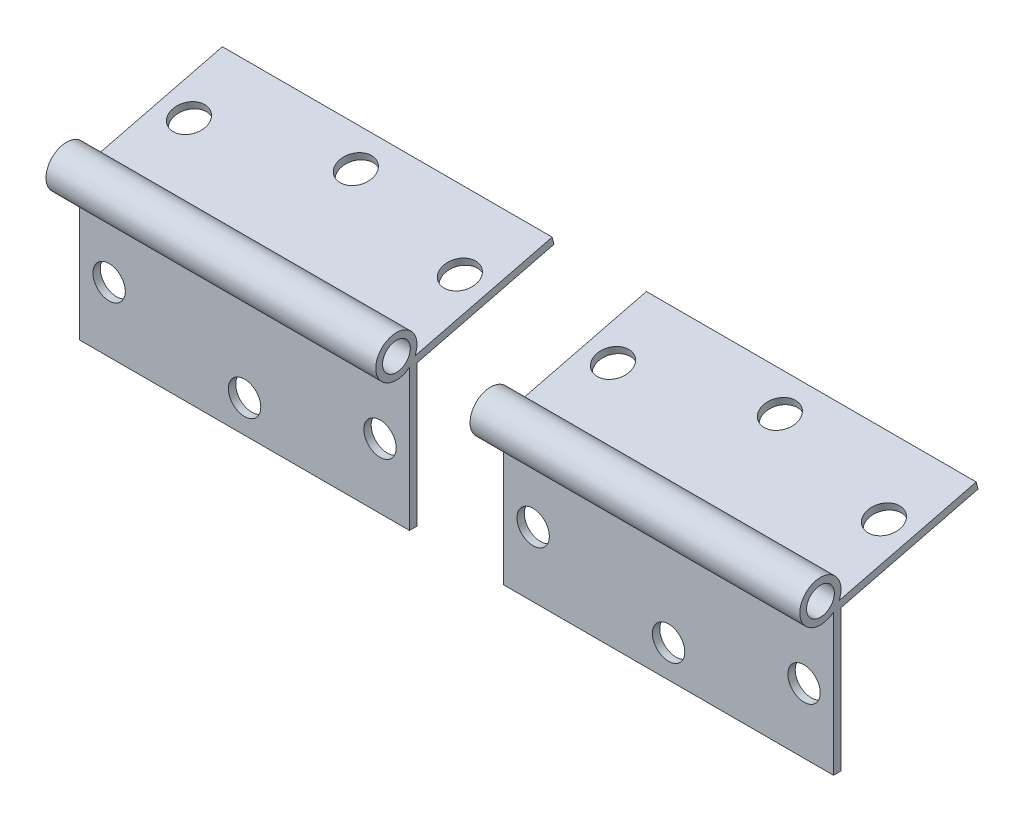
from build123d import *

# Parameters (mm, degrees)
BOSS_EXTRUDE1_DEPTH = 101.6
SKETCH2_R           = 4.365625
SKETCH2_W           = 25.4
SKETCH2_H           = 52.737821571
CUT_EXTRUDE1_DEPTH  = 111.232355814


with BuildPart() as part:
    # Sketch1 → Boss-Extrude1 (new, symmetric)
    with BuildSketch(Plane(origin=(0, 0, 0), x_dir=(0, 0, -1), z_dir=(1, 0, 0))):
        with BuildLine():
            Line((-2.955552608, 2.309130771), (-4.37838475, 3.420769072))
            ThreePointArc((-4.37838475, 3.420769072), (-3.884105647, -3.973114318), (3.519077491, -4.299768328))
            Line((3.519077491, -4.299768328), (3.519077491, -42.399768328))
            Line((3.519077491, -42.399768328), (5.503452491, -42.399768328))
            Line((5.503452491, -42.399768328), (5.503452491, -4.299768328))
            Line((5.503452491, -4.299768328), (2.955552608, -2.309130771))
            ThreePointArc((2.955552608, -2.309130771), (-2.309130771, -2.955552608), (-2.955552608, 2.309130771))
        make_face()
    boss_extrude1 = extrude(amount=BOSS_EXTRUDE1_DEPTH, both=True)

    # Sketch2 → Cut-Extrude1 (cut, symmetric)
    with BuildSketch(Plane.XY):
        with Locations((-93.6625, -24.937268328)):
            Circle(SKETCH2_R)
        with Locations((-20.6375, -24.937268328)):
            Circle(SKETCH2_R)
        with Locations((20.6375, -24.937268328)):
            Circle(SKETCH2_R)
        with Locations((93.6625, -24.937268328)):
            Circle(SKETCH2_R)
        with Locations((-57.15, -33.668518328)):
            Circle(SKETCH2_R)
        with Locations((57.15, -33.668518328)):
            Circle(SKETCH2_R)
        with Locations((0, -16.030857543)):
            Rectangle(SKETCH2_W, SKETCH2_H)
    cut_extrude1 = extrude(amount=CUT_EXTRUDE1_DEPTH, both=True, mode=Mode.SUBTRACT)


with BuildPart() as cut_extrude1_piece_1:
    # of the separate pieces the step leaves, piece 1, a body of its own (cut_extrude1_pieces)
    add(part.part.solids().sort_by_distance((101.6, -2.309130771, -2.955552608))[0])



with BuildPart() as cut_extrude1_piece_2:
    # of the separate pieces the step leaves, piece 2, a body of its own (cut_extrude1_pieces)
    add(part.part.solids().sort_by_distance((-12.7, -2.309130771, -2.955552608))[0])


with BuildPart() as cut_extrude1_piece_1_1:
    add(cut_extrude1_piece_1.part)

    add(cut_extrude1_piece_2.part)  # Mirror2 merges Cut-Extrude1 piece 2
    # Mirror2: Boss-Extrude1 across plane
    add(boss_extrude1.mirror(Plane(origin=(101.6, 0, 0), x_dir=(0, 0.6156614753256557, 0.7880107536067239), z_dir=(0, 0.788010753606724, -0.6156614753256557))))

    # Mirror2 2: Cut-Extrude1 across plane
    add(cut_extrude1.mirror(Plane(origin=(101.6, 0, 0), x_dir=(0, 0.6156614753256557, 0.7880107536067239), z_dir=(0, 0.788010753606724, -0.6156614753256557))), mode=Mode.SUBTRACT)


solid = cut_extrude1_piece_1_1.part
